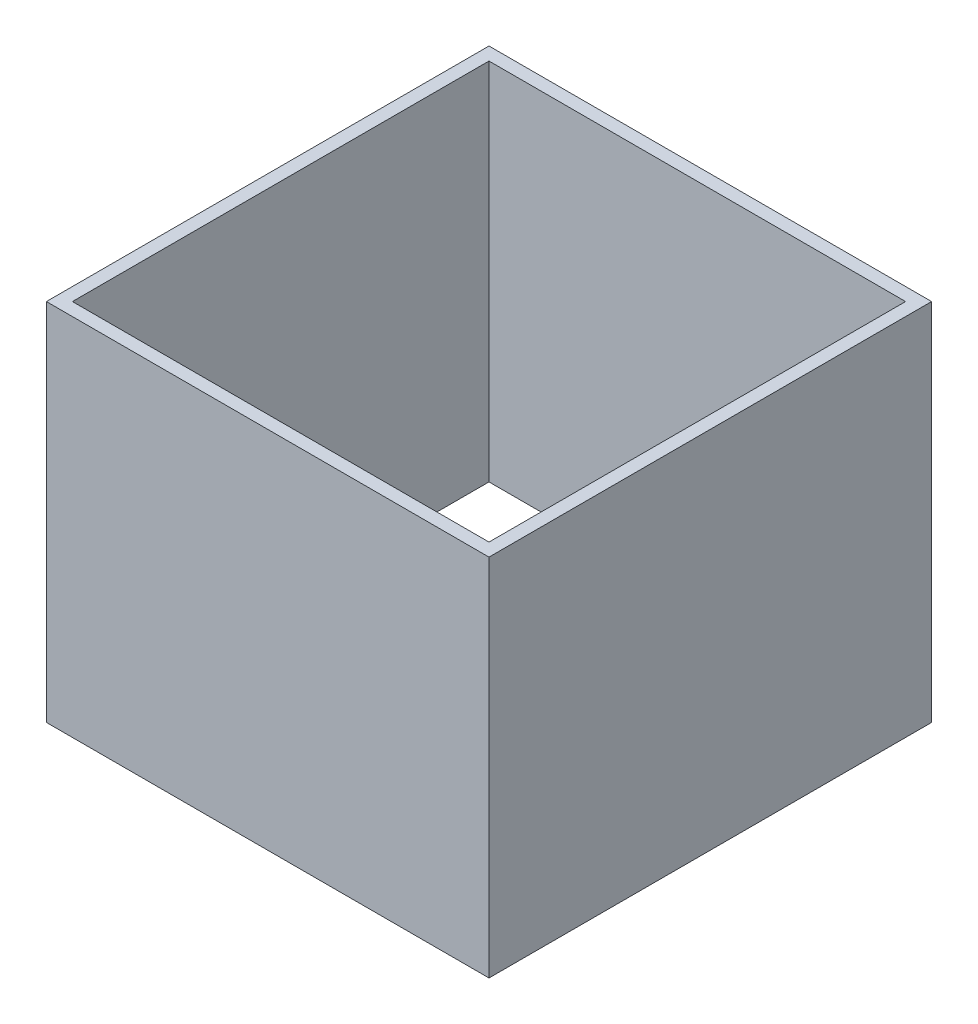
from build123d import *

# Parameters (mm, degrees)
SKETCH1_W           = 215.9
SKETCH1_H           = 215.9
SKETCH1_W_2         = 203.2
SKETCH1_H_2         = 203.2
EXTRUDE_THIN1_DEPTH = 177.8


with BuildPart() as part:
    # Sketch1 → Extrude-Thin1 (new body)
    with BuildSketch(Plane(origin=(0, 0, 0), x_dir=(1, 0, 0), z_dir=(0, 1, 0))):
        Rectangle(SKETCH1_W, SKETCH1_H)
        Rectangle(SKETCH1_W_2, SKETCH1_H_2, mode=Mode.SUBTRACT)
    extrude(amount=EXTRUDE_THIN1_DEPTH)


solid = part.part
